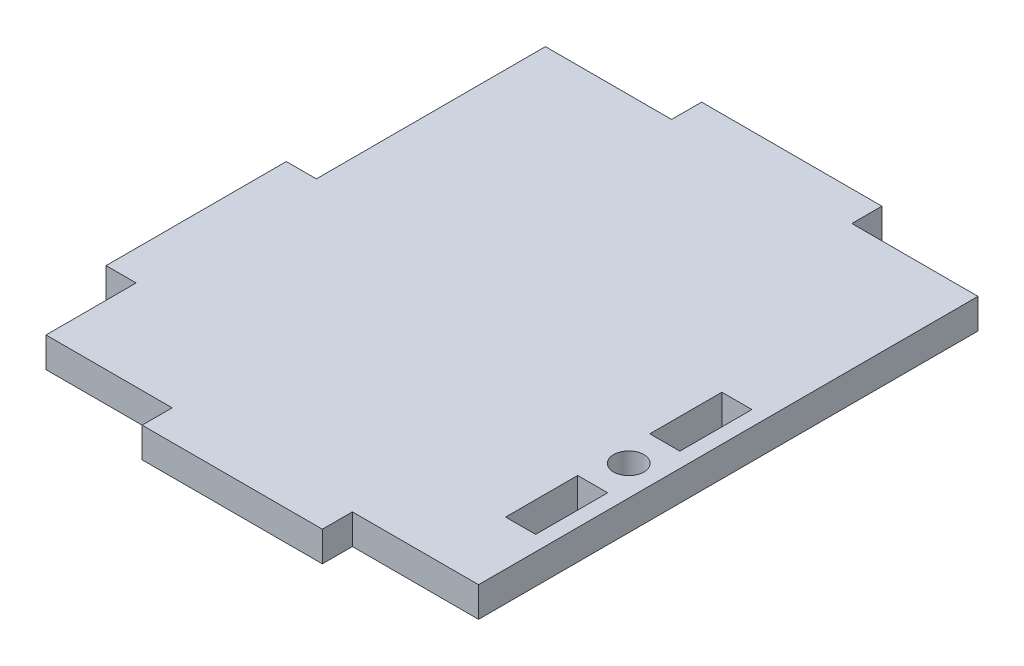
from build123d import *

# Parameters (mm, degrees)
SKETCH1_W            = 3.175
SKETCH1_H            = 7.62
BOSS_EXTRUDE1_DEPTH  = 3.175
M3_CLEARANCE_HOLE1_D = 3.2


with BuildPart() as part:
    # Sketch1 → Boss-Extrude1 (new body)
    with BuildSketch(Plane(origin=(0, 0, 0), x_dir=(1, 0, 0), z_dir=(0, 1, 0))):
        Polygon((0, 0), (13.335, 0), (13.335, -3.175), (32.385, -3.175), (32.385, 0), (45.72, 0), (45.72, 52.78882), (32.385, 52.78882), (32.385, 55.96382), (13.335, 55.96382), (13.335, 52.78882), (0, 52.78882), (0, 28.575), (-3.175, 28.575), (-3.175, 9.525), (0, 9.525), align=None)
        with Locations((42.545, 26.67)):
            Rectangle(SKETCH1_W, SKETCH1_H, mode=Mode.SUBTRACT)
        with Locations((42.545, 11.43)):
            Rectangle(SKETCH1_W, SKETCH1_H, mode=Mode.SUBTRACT)
    extrude(amount=BOSS_EXTRUDE1_DEPTH)

    # M3 Clearance Hole1 (through all)
    with Locations(Plane(origin=(0, 3.175, 0), x_dir=(1, 0, 0), z_dir=(0, 1, 0))):
        with Locations((42.545, 19.05)):
            Hole(M3_CLEARANCE_HOLE1_D / 2)


solid = part.part
